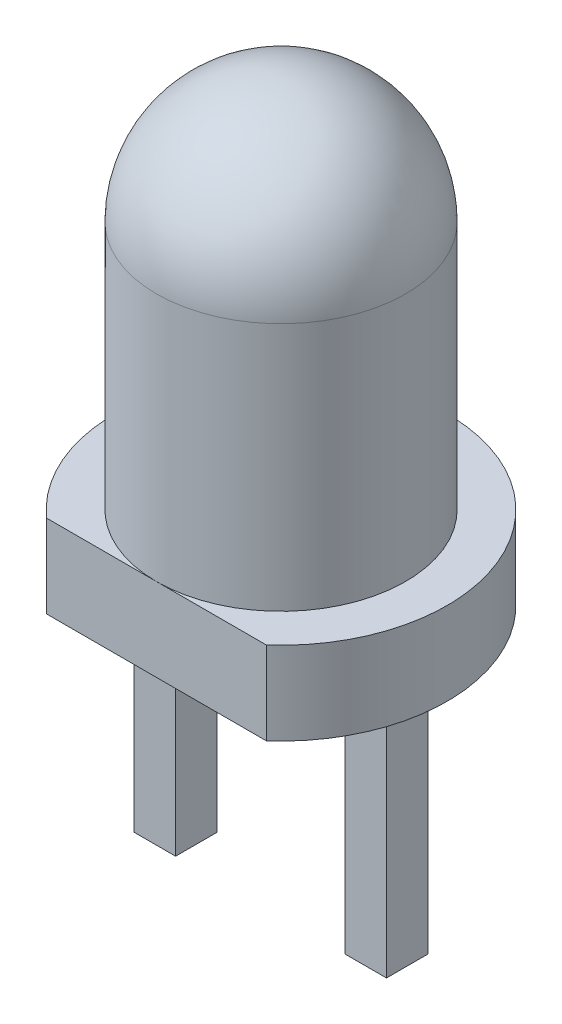
from build123d import *

# Parameters (mm, degrees)
BOSS_EXTRUDE1_DEPTH   = 0.5
SKETCH3_W             = 0.5
SKETCH3_H             = 0.5
BOSS_EXTRUDE2_DEPTH   = 3
BOSS_EXTRUDE2_2_DEPTH = 3


with BuildPart() as part:
    # Sketch1 → Revolve1 (revolve)
    with BuildSketch(Plane(origin=(0, 0, 0), x_dir=(0, 0, -1), z_dir=(1, 0, 0))):
        with BuildLine():
            Line((-1.5, 0), (-1.5, 3.5))
            ThreePointArc((-1.5, 3.5), (-1.060660172, 4.560660172), (0, 5))
            Line((0, 5), (0, 0))
            Line((0, 0), (-1.5, 0))
        make_face()
    revolve(axis=Axis((0, 5, 0), (0, -1, 0)))

    # Sketch2 → Boss-Extrude1 (add, symmetric)
    with BuildSketch(Plane(origin=(0, 0, 0), x_dir=(1, 0, 0), z_dir=(0, 1, 0))):
        with BuildLine():
            Line((-1.322875656, -1.5), (1.322875656, -1.5))
            ThreePointArc((1.322875656, -1.5), (0, 2), (-1.322875656, -1.5))
        make_face()
    extrude(amount=BOSS_EXTRUDE1_DEPTH, both=True)


with BuildPart() as body_2:
    # Sketch3 → Boss-Extrude2 (new body)
    with BuildSketch(Plane.XZ.offset(0.5)):
        with Locations((-1.27, 0)):
            Rectangle(SKETCH3_W, SKETCH3_H)
    extrude(amount=BOSS_EXTRUDE2_DEPTH)


with BuildPart() as body_3:
    # Sketch3 → Boss-Extrude2 2 (new body)
    with BuildSketch(Plane.XZ.offset(0.5)):
        with Locations((1.27, 0)):
            Rectangle(SKETCH3_W, SKETCH3_H)
    extrude(amount=BOSS_EXTRUDE2_2_DEPTH)


solid = Compound([part.part, body_2.part, body_3.part])
